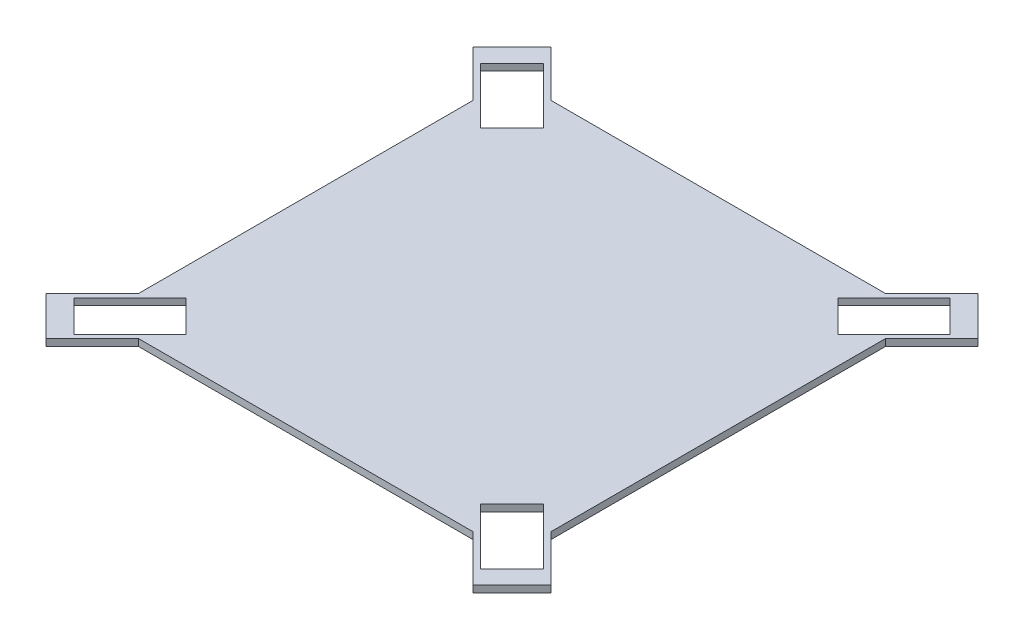
from build123d import *

# Parameters (mm, degrees)
BOSS_EXTRUDE1_DEPTH = 2


with BuildPart() as part:
    # Sketch1 → Boss-Extrude1 (new body)
    with BuildSketch(Plane(origin=(0, 0, 0), x_dir=(1, 0, 0), z_dir=(0, 1, 0))):
        Polygon((48.656170244, -59.969878742), (-48.656170244, -59.969878742), (-62.091199086, -73.404907585), (-73.404907585, -62.091199086), (-59.969878742, -48.656170244), (-59.969878742, 48.656170244), (-73.404907585, 62.091199086), (-62.091199086, 73.404907585), (-48.656170244, 59.969878742), (48.656170244, 59.969878742), (62.091199086, 73.404907585), (73.404907585, 62.091199086), (59.969878742, 48.656170244), (59.969878742, -48.656170244), (73.404907585, -62.091199086), (62.091199086, -73.404907585), align=None)
        Polygon((59.050639927, 68.243028082), (68.243028082, 59.050639927), (51.979572115, 42.78718396), (42.78718396, 51.979572115), align=None, mode=Mode.SUBTRACT)
        Polygon((68.243028082, -59.050639927), (51.979572115, -42.78718396), (42.78718396, -51.979572115), (59.050639927, -68.243028082), align=None, mode=Mode.SUBTRACT)
        Polygon((-59.050639927, -68.243028082), (-68.243028082, -59.050639927), (-51.979572115, -42.78718396), (-42.78718396, -51.979572115), align=None, mode=Mode.SUBTRACT)
        Polygon((-68.243028082, 59.050639927), (-51.979572115, 42.78718396), (-42.78718396, 51.979572115), (-59.050639927, 68.243028082), align=None, mode=Mode.SUBTRACT)
    extrude(amount=BOSS_EXTRUDE1_DEPTH)


solid = part.part
